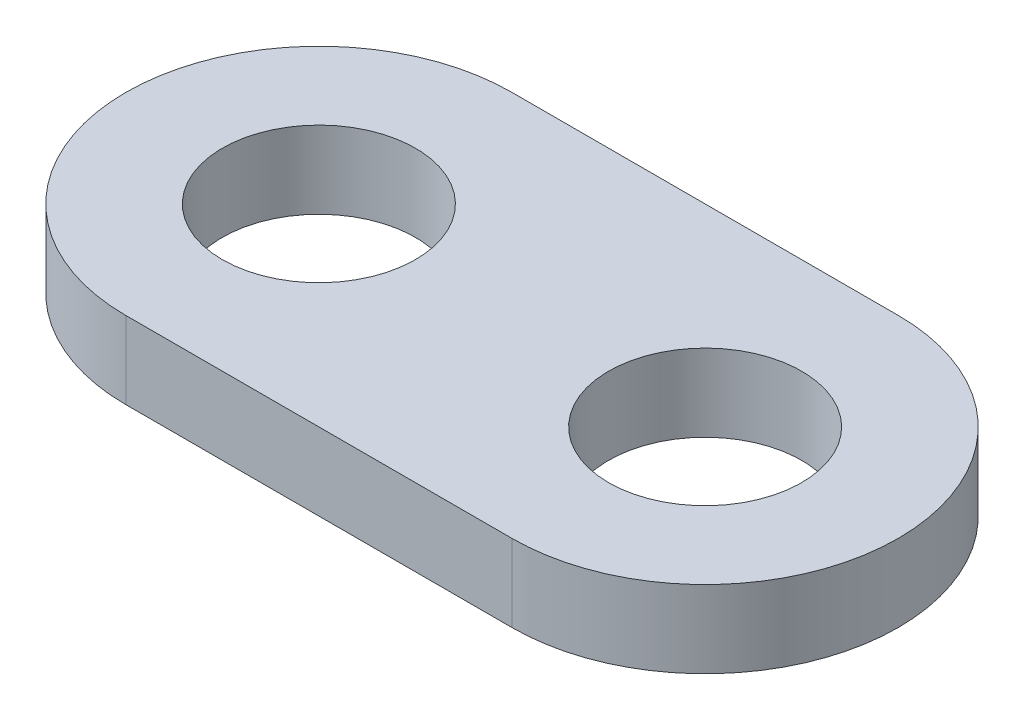
from build123d import *

# Parameters (mm, degrees)
BOSS_EXTRUDE1_DEPTH = 2.54
SKETCH2_R           = 3.175
CUT_EXTRUDE1_DEPTH  = 15.424427198


with BuildPart() as part:
    # Sketch1 → Boss-Extrude1 (new body)
    with BuildSketch(Plane(origin=(0, 0, 0), x_dir=(1, 0, 0), z_dir=(0, 1, 0))):
        with BuildLine():
            Line((-6.35, -6.35), (6.35, -6.35))
            ThreePointArc((6.35, -6.35), (12.7, 0), (6.35, 6.35))
            Line((6.35, 6.35), (-6.35, 6.35))
            ThreePointArc((-6.35, 6.35), (-12.7, 0), (-6.35, -6.35))
        make_face()
    extrude(amount=BOSS_EXTRUDE1_DEPTH)

    # Sketch2 → Cut-Extrude1 (cut, through all)
    with BuildSketch(Plane(origin=(0, 2.54, 0), x_dir=(1, 0, 0), z_dir=(0, 1, 0))):
        with Locations(Location((-6.35, 0, 0), (0, 0, 270))):
            Circle(SKETCH2_R)
        with Locations(Location((6.35, 0, 0), (0, 0, 270))):
            Circle(SKETCH2_R)
    extrude(amount=-CUT_EXTRUDE1_DEPTH, mode=Mode.SUBTRACT)


solid = part.part
